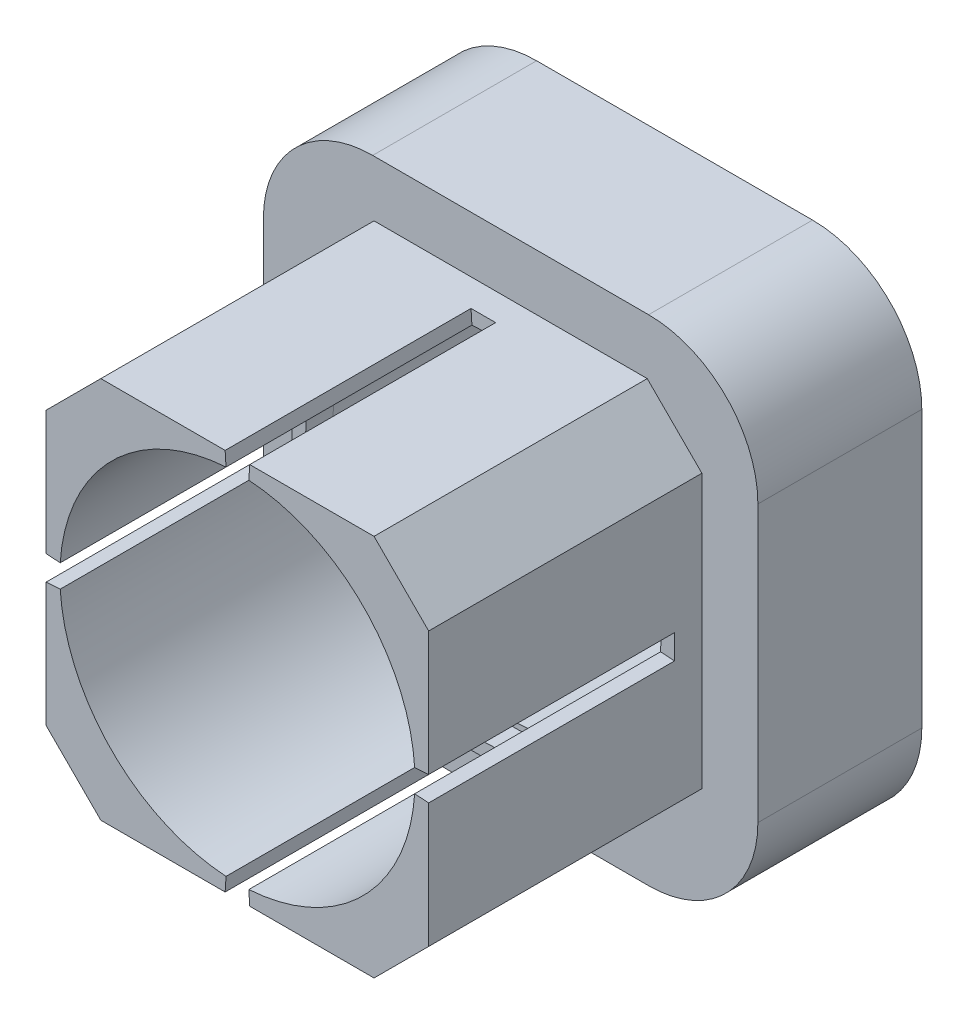
from build123d import *

# Parameters (mm, degrees)
BOSS_EXTRUDE1_DEPTH = 6
SKETCH3_R           = 6.5
BOSS_EXTRUDE2_DEPTH = 10
CUT_EXTRUDE7_DEPTH  = 9
CIRPATTERN1_COUNT   = 4
SKETCH12_R          = 6.5
CUT_EXTRUDE8_DEPTH  = 30


with BuildPart() as part:
    # Sketch1 → Boss-Extrude1 (new body)
    with BuildSketch(Plane.XY):
        with BuildLine():
            Line((-5.05, 9.05), (5.05, 9.05))
            ThreePointArc((5.05, 9.05), (7.878427125, 7.878427125), (9.05, 5.05))
            Line((9.05, 5.05), (9.05, -5.05))
            ThreePointArc((9.05, -5.05), (7.878427125, -7.878427125), (5.05, -9.05))
            Line((5.05, -9.05), (-5.05, -9.05))
            ThreePointArc((-5.05, -9.05), (-7.878427125, -7.878427125), (-9.05, -5.05))
            Line((-9.05, -5.05), (-9.05, 5.05))
            ThreePointArc((-9.05, 5.05), (-7.878427125, 7.878427125), (-5.05, 9.05))
        make_face()
    extrude(amount=BOSS_EXTRUDE1_DEPTH)

    # Sketch3 → Boss-Extrude2 (add)
    with BuildSketch(Plane.XY.offset(6)):
        Polygon((-5, -7), (5, -7), (7, -5), (7, 5), (5, 7), (-5, 7), (-7, 5), (-7, -5), align=None)
        Circle(SKETCH3_R, mode=Mode.SUBTRACT)
    extrude(amount=BOSS_EXTRUDE2_DEPTH)

    # Sketch11 → Cut-Extrude7 (cut)
    with BuildSketch(Plane.XY.offset(16)):
        Polygon((0, 0), (7, 0.45), (7, -0.45), align=None)
    cut_extrude7 = extrude(amount=-CUT_EXTRUDE7_DEPTH, mode=Mode.SUBTRACT)

    # CirPattern1: Cut-Extrude7 ×4 about axis
    cirpattern1_axis = Axis((0, 0, 16), (0, 0, -1))
    for i in range(1, CIRPATTERN1_COUNT):
        add(cut_extrude7.rotate(cirpattern1_axis, i * 360 / CIRPATTERN1_COUNT), mode=Mode.SUBTRACT)

    # Sketch12 → Cut-Extrude8 (cut)
    with BuildSketch(Plane.XY.offset(6)):
        with Locations(Location((0, 0.192488852, 0), (0, 0, 359.151599859))):
            Circle(SKETCH12_R)
    extrude(amount=-CUT_EXTRUDE8_DEPTH, mode=Mode.SUBTRACT)


solid = part.part
